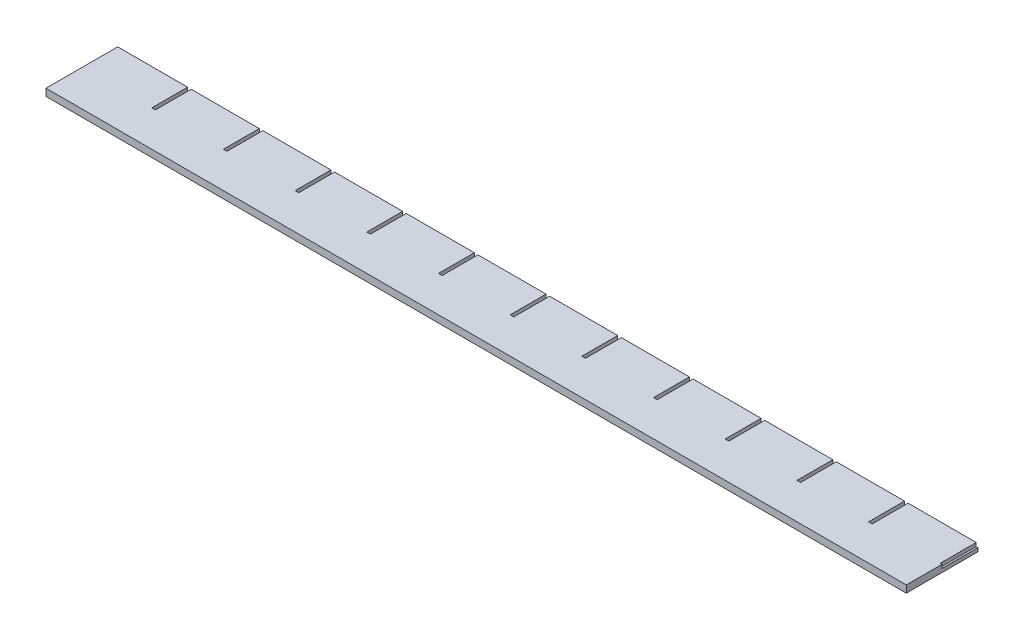
from build123d import *

# Parameters (mm, degrees)
SKETCH1_W           = 304.8
SKETCH1_H           = 25.4
BOSS_EXTRUDE1_DEPTH = 2.54
SKETCH2_W           = 0.635
SKETCH2_H           = 12.7
CUT_EXTRUDE1_DEPTH  = 1.27


with BuildPart() as part:
    # Sketch1 → Boss-Extrude1 (new body)
    with BuildSketch(Plane(origin=(0, 0, 0), x_dir=(1, 0, 0), z_dir=(0, 1, 0))):
        Rectangle(SKETCH1_W, SKETCH1_H)
    extrude(amount=BOSS_EXTRUDE1_DEPTH)

    # Sketch2 → Cut-Extrude1 (cut)
    with BuildSketch(Plane(origin=(0, 2.54, 0), x_dir=(1, 0, 0), z_dir=(0, 1, 0))):
        with Locations((-127.3175, 6.35)):
            Rectangle(SKETCH2_W, SKETCH2_H)
        with Locations((-126.6825, 6.35)):
            Rectangle(SKETCH2_W, SKETCH2_H)
        with Locations((-101.9175, 6.35)):
            Rectangle(SKETCH2_W, SKETCH2_H)
        with Locations((-101.2825, 6.35)):
            Rectangle(SKETCH2_W, SKETCH2_H)
        with Locations((-75.8825, 6.35)):
            Rectangle(SKETCH2_W, SKETCH2_H)
        with Locations((-76.5175, 6.35)):
            Rectangle(SKETCH2_W, SKETCH2_H)
        with Locations((-51.1175, 6.35)):
            Rectangle(SKETCH2_W, SKETCH2_H)
        with Locations((-50.4825, 6.35)):
            Rectangle(SKETCH2_W, SKETCH2_H)
        with Locations((-25.7175, 6.35)):
            Rectangle(SKETCH2_W, SKETCH2_H)
        with Locations((-25.0825, 6.35)):
            Rectangle(SKETCH2_W, SKETCH2_H)
        with Locations((-0.3175, 6.35)):
            Rectangle(SKETCH2_W, SKETCH2_H)
        with Locations((0.3175, 6.35)):
            Rectangle(SKETCH2_W, SKETCH2_H)
        with Locations((25.0825, 6.35)):
            Rectangle(SKETCH2_W, SKETCH2_H)
        with Locations((25.7175, 6.35)):
            Rectangle(SKETCH2_W, SKETCH2_H)
        with Locations((50.4825, 6.35)):
            Rectangle(SKETCH2_W, SKETCH2_H)
        with Locations((51.1175, 6.35)):
            Rectangle(SKETCH2_W, SKETCH2_H)
        with Locations((75.8825, 6.35)):
            Rectangle(SKETCH2_W, SKETCH2_H)
        with Locations((76.5175, 6.35)):
            Rectangle(SKETCH2_W, SKETCH2_H)
        with Locations((101.2825, 6.35)):
            Rectangle(SKETCH2_W, SKETCH2_H)
        with Locations((101.9175, 6.35)):
            Rectangle(SKETCH2_W, SKETCH2_H)
        with Locations((126.6825, 6.35)):
            Rectangle(SKETCH2_W, SKETCH2_H)
        with Locations((127.3175, 6.35)):
            Rectangle(SKETCH2_W, SKETCH2_H)
        with Locations((152.0825, 6.35)):
            Rectangle(SKETCH2_W, SKETCH2_H)
    extrude(amount=-CUT_EXTRUDE1_DEPTH, mode=Mode.SUBTRACT)


solid = part.part
